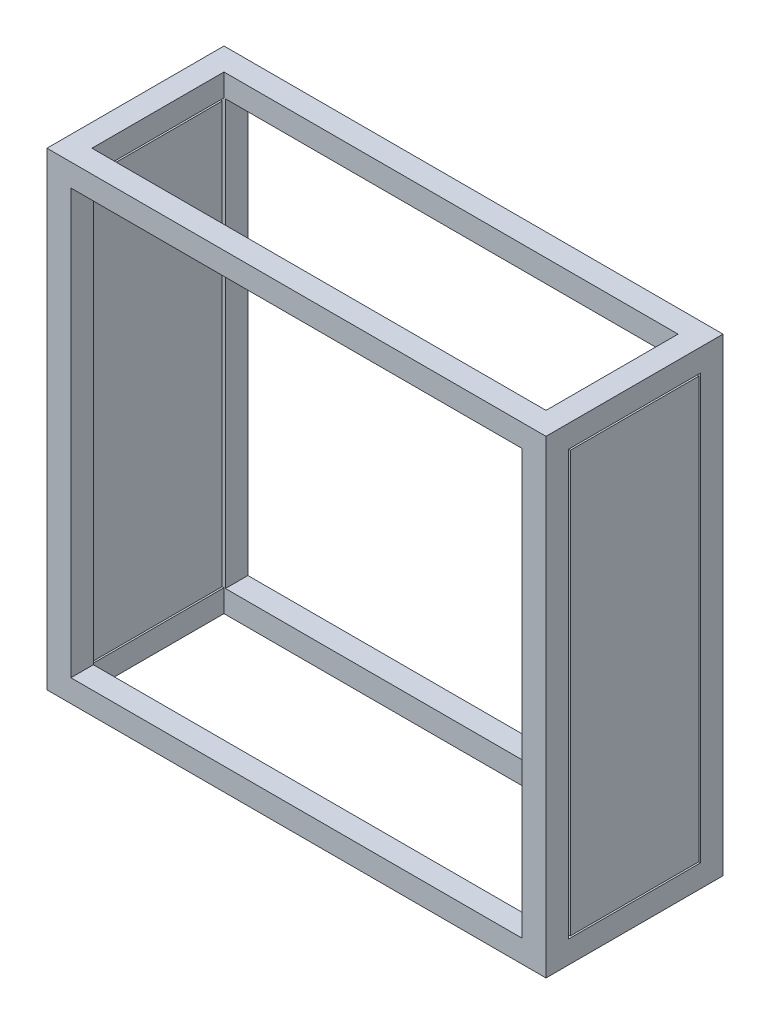
from build123d import *

# Parameters (mm, degrees)
CROQUIS1_W              = 563.8
CROQUIS1_H              = 530
CROQUIS1_W_2            = 509.760301886
CROQUIS1_H_2            = 479.2
SALIENTE_EXTRUIR1_DEPTH = 200
CORTAR_EXTRUIR1_REACH   = 656.29
CROQUIS2_W              = 149.2
CROQUIS2_H              = 479.2
CROQUIS3_W              = 513
CROQUIS3_H              = 149.2
CORTAR_EXTRUIR2_DEPTH   = 410
CROQUIS4_W              = 513
CROQUIS4_H              = 149.2
CORTAR_EXTRUIR3_DEPTH   = 40
CROQUIS5_W              = 145.2
CROQUIS5_H              = 475.2
SALIENTE_EXTRUIR2_DEPTH = 25.4
CROQUIS6_W              = 145.2
CROQUIS6_H              = 475.2
SALIENTE_EXTRUIR3_DEPTH = 25.4
CROQUIS9_W              = 145.2
CROQUIS9_H              = 475.2
CORTAR_EXTRUIR4_DEPTH   = 10
CROQUIS10_R             = 3.175
CORTAR_EXTRUIR5_DEPTH   = 10


with BuildPart() as part:
    # Croquis1 → Saliente-Extruir1 (new body)
    with BuildSketch(Plane.XY):
        Rectangle(CROQUIS1_W, CROQUIS1_H)
        Rectangle(CROQUIS1_W_2, CROQUIS1_H_2, mode=Mode.SUBTRACT)
    extrude(amount=-SALIENTE_EXTRUIR1_DEPTH)

    # Cortar-Extruir1: up to this face of the body (flat: up to its plane)
    cortar_extruir1_end = Plane(part.part.faces().sort_by_distance((-281.9, 0, -100))[0])
    # Croquis2 → Cortar-Extruir1 (cut, up to the picked face)
    with BuildSketch(Plane(origin=(281.9, 0, 0), x_dir=(0, 0, -1), z_dir=(1, 0, 0)), mode=Mode.PRIVATE) as cortar_extruir1_sk1:
        with Locations((100, 0)):
            Rectangle(CROQUIS2_W, CROQUIS2_H)
    cortar_extruir1_tool1 = split(extrude(cortar_extruir1_sk1.sketch, amount=-CORTAR_EXTRUIR1_REACH, mode=Mode.PRIVATE), bisect_by=cortar_extruir1_end, keep=Keep.BOTH, mode=Mode.PRIVATE)
    add(cortar_extruir1_tool1.solids().sort_by(Axis((281.9, 0, -100), (-1, 0, 0)))[0], mode=Mode.SUBTRACT)

    # Croquis3 → Cortar-Extruir2 (cut)
    with BuildSketch(Plane(origin=(0, 265, 0), x_dir=(1, 0, 0), z_dir=(0, 1, 0))):
        with Locations((0, 100)):
            Rectangle(CROQUIS3_W, CROQUIS3_H)
    extrude(amount=-CORTAR_EXTRUIR2_DEPTH, mode=Mode.SUBTRACT)

    # Croquis4 → Cortar-Extruir3 (cut)
    with BuildSketch(Plane.XZ.offset(265)):
        with Locations((0, -100)):
            Rectangle(CROQUIS4_W, CROQUIS4_H)
    extrude(amount=-CORTAR_EXTRUIR3_DEPTH, mode=Mode.SUBTRACT)

    # Croquis10 → Cortar-Extruir5 (cut)
    with BuildSketch(Plane.XZ.offset(265)):
        with Locations(Location((269.2, -162, 0), (0, 0, 270))):
            Circle(CROQUIS10_R)
        with Locations(Location((-269.2, -162, 0), (0, 0, 90))):
            Circle(CROQUIS10_R)
        with Locations(Location((-269.2, -38, 0), (0, 0, 270))):
            Circle(CROQUIS10_R)
        with Locations(Location((269.2, -38, 0), (0, 0, 90))):
            Circle(CROQUIS10_R)
    extrude(amount=-CORTAR_EXTRUIR5_DEPTH, mode=Mode.SUBTRACT)


with BuildPart() as body_2:
    # Croquis5 → Saliente-Extruir2 (new body)
    with BuildSketch(Plane(origin=(281.9, 0, 0), x_dir=(0, 0, -1), z_dir=(1, 0, 0))):
        with Locations((100, 0)):
            Rectangle(CROQUIS5_W, CROQUIS5_H)
    extrude(amount=-SALIENTE_EXTRUIR2_DEPTH)


with BuildPart() as body_3:
    # Croquis6 → Saliente-Extruir3 (new body)
    with BuildSketch(Plane.ZY.offset(281.9)):
        with Locations((-100, 0)):
            Rectangle(CROQUIS6_W, CROQUIS6_H)
    extrude(amount=-SALIENTE_EXTRUIR3_DEPTH)

    # Croquis9 → Cortar-Extruir4 (cut)
    with BuildSketch(Plane.ZY.offset(281.9)):
        with Locations((-100, 0)):
            Rectangle(CROQUIS9_W, CROQUIS9_H)
    extrude(amount=-CORTAR_EXTRUIR4_DEPTH, mode=Mode.SUBTRACT)


solid = Compound([part.part, body_2.part, body_3.part])
